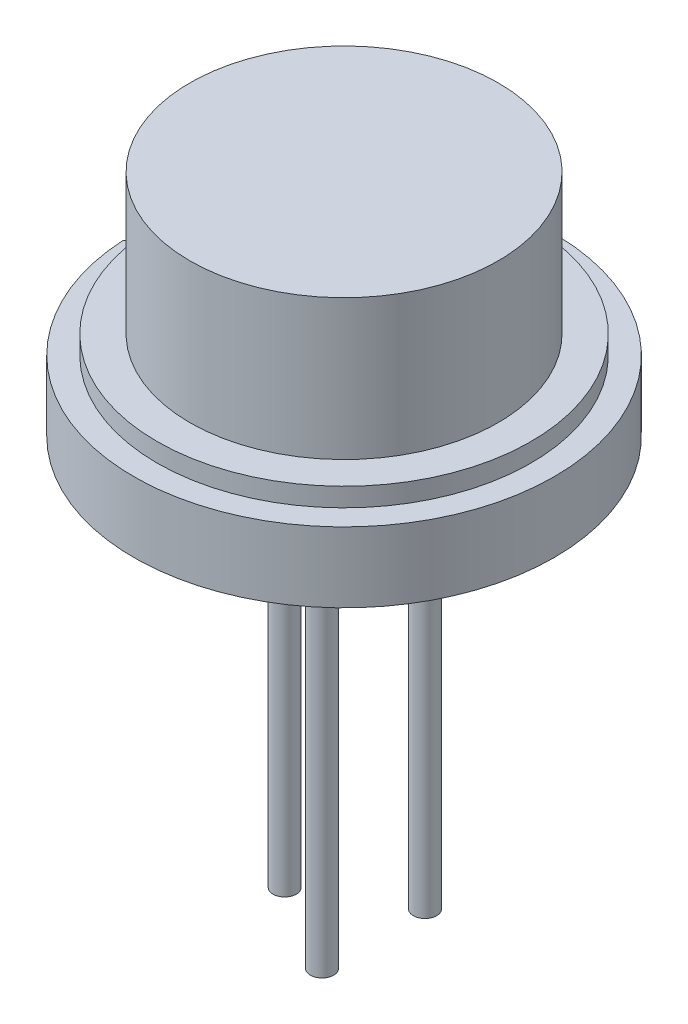
from build123d import *

# Parameters (mm, degrees)
SKETCH_2_R        = 0.25
EXTRUDE_1_DEPTH   = 9
EXTRUDE_1_2_DEPTH = 9
EXTRUDE_1_3_DEPTH = 9
EXTRUDE_2_DEPTH   = 1.5
SKETCH_4_R        = 4
EXTRUDE_3_DEPTH   = 0.4
SKETCH_5_R        = 3.3
EXTRUDE_4_DEPTH   = 3


with BuildPart() as part:
    # Эскиз2 → Бобышка-Вытянуть1 (new body)
    with BuildSketch(Plane(origin=(0, 0, 0), x_dir=(1, 0, 0), z_dir=(0, 1, 0))):
        with Locations(Location((-1.27, 0, 0), (0, 0, 270))):
            Circle(SKETCH_2_R)
    extrude(amount=EXTRUDE_1_DEPTH)



with BuildPart() as body_2:
    # Эскиз2 → Extrude 1 2 (new body)
    with BuildSketch(Plane(origin=(0, 0, 0), x_dir=(1, 0, 0), z_dir=(0, 1, 0))):
        with Locations(Location((0.630957819, 1.102176134, 0), (0, 0, 270))):
            Circle(SKETCH_2_R)
    extrude(amount=EXTRUDE_1_2_DEPTH)


with BuildPart() as body_3:
    # Эскиз2 → Extrude 1 3 (new body)
    with BuildSketch(Plane(origin=(0, 0, 0), x_dir=(1, 0, 0), z_dir=(0, 1, 0))):
        with Locations(Location((0.630957819, -1.102176134, 0), (0, 0, 270))):
            Circle(SKETCH_2_R)
    extrude(amount=EXTRUDE_1_3_DEPTH)


with BuildPart() as part_1:
    add(part.part)

    add(body_2.part)  # Бобышка-Вытянуть2 merges body 2

    add(body_3.part)  # Бобышка-Вытянуть2 merges body 3
    # Эскиз3 → Бобышка-Вытянуть2 (add)
    with BuildSketch(Plane(origin=(0, 9, 0), x_dir=(1, 0, 0), z_dir=(0, 1, 0))):
        with BuildLine():
            Line((-4.247340401, 0), (-4.493274572, 0.245934171))
            ThreePointArc((-4.493274572, 0.245934171), (4.5, 0), (-4.493274572, -0.245934171))
            Line((-4.493274572, -0.245934171), (-4.247340401, 0))
        make_face()
    extrude(amount=EXTRUDE_2_DEPTH)

    # Эскиз4 → Бобышка-Вытянуть3 (add)
    with BuildSketch(Plane(origin=(0, 10.5, 0), x_dir=(1, 0, 0), z_dir=(0, 1, 0))):
        with Locations(Location((0, 0, 0), (0, 0, 270))):
            Circle(SKETCH_4_R)
    extrude(amount=EXTRUDE_3_DEPTH)

    # Эскиз5 → Бобышка-Вытянуть4 (add)
    with BuildSketch(Plane(origin=(0, 10.9, 0), x_dir=(1, 0, 0), z_dir=(0, 1, 0))):
        with Locations(Location((0, 0, 0), (0, 0, 270))):
            Circle(SKETCH_5_R)
    extrude(amount=EXTRUDE_4_DEPTH)


solid = part_1.part
